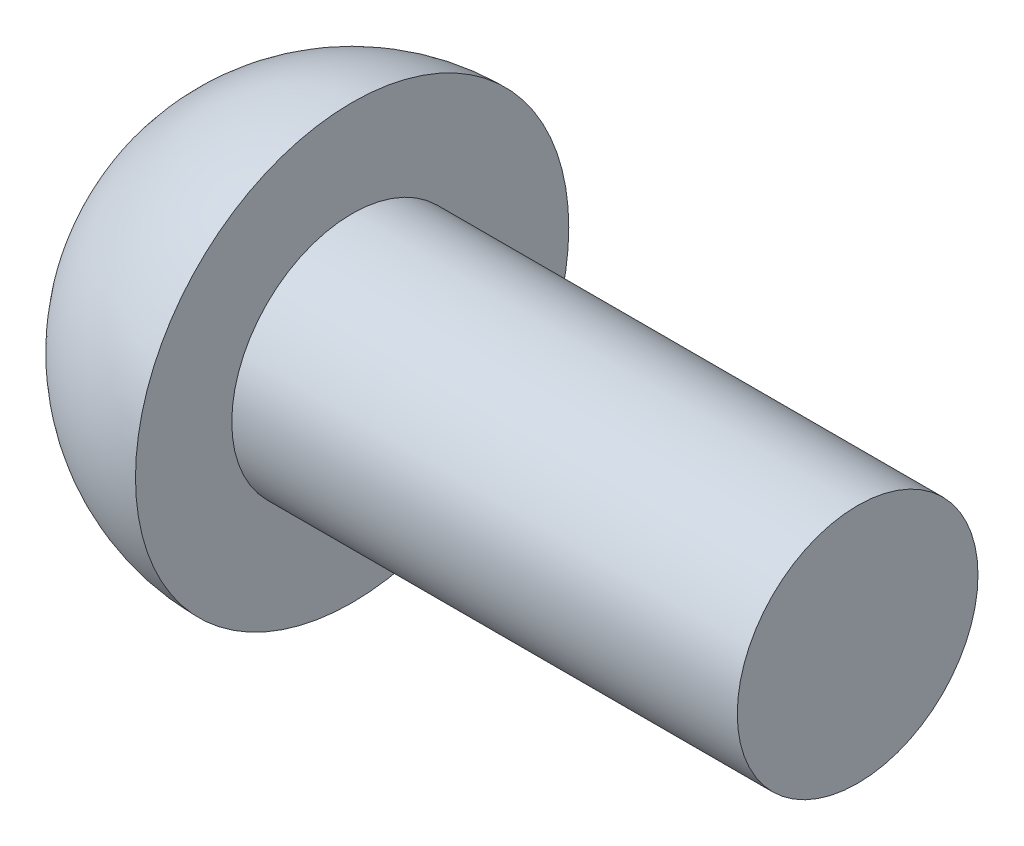
from build123d import *


with BuildPart() as part:
    # Sketch2 → Revolve1 (revolve)
    with BuildSketch(Plane.XY, mode=Mode.PRIVATE) as revolve1_sk:
        with BuildLine():
            Line((0, 0), (-21, 0))
            Line((-21, 0), (-21, 4))
            ThreePointArc((-21, 4), (-27.363961031, 1.363961031), (-30, -5))
            Line((-30, -5), (0, -5))
            Line((0, -5), (0, 0))
        make_face()
    revolve(revolve1_sk.sketch.rotate(Axis((-30, -5, 0), (1, 0, 0)), 90), axis=Axis((-30, -5, 0), (1, 0, 0)))


solid = part.part
